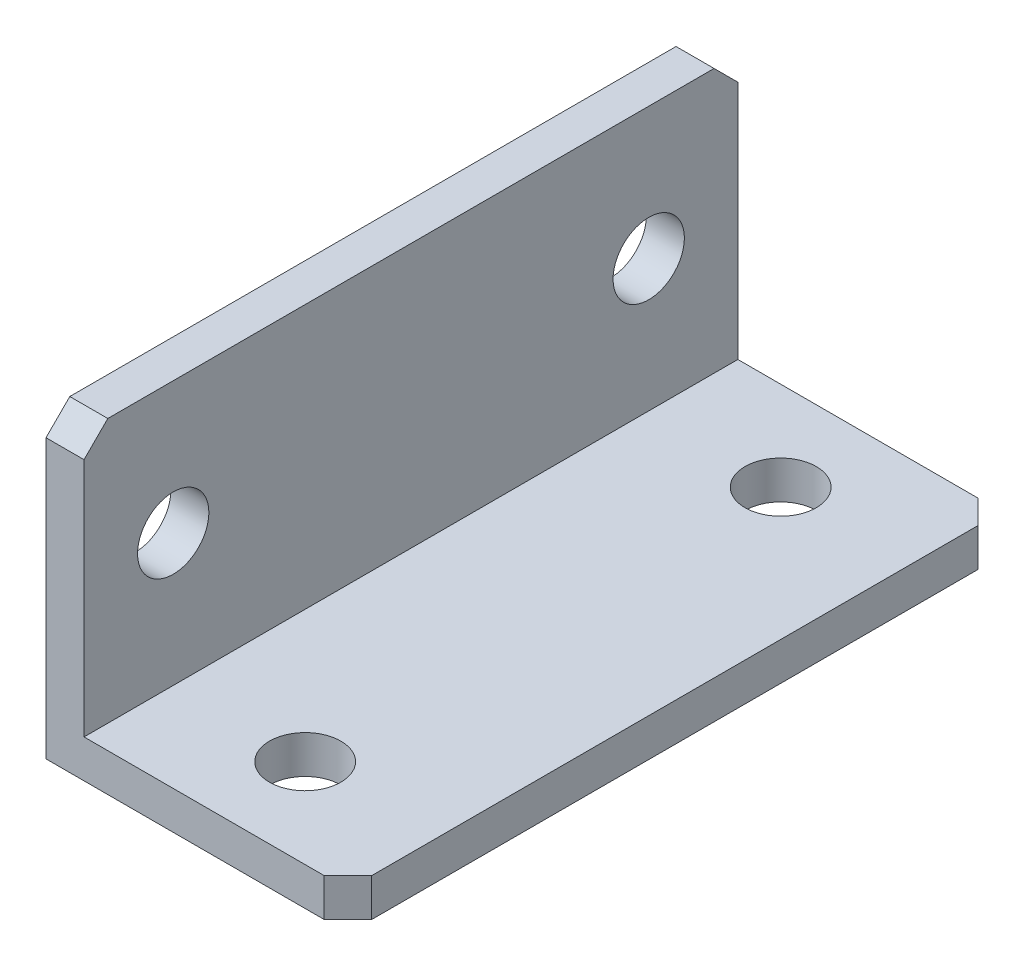
from build123d import *

# Parameters (mm, degrees)
RESSALTO_EXTRUS_O1_DEPTH = 55
CHANFRO1_SIZE            = 2
ESBO_O2_R                = 3
CORTE_EXTRUS_O1_DEPTH    = 64.329929733
ESBO_O3_R                = 3
CORTE_EXTRUS_O2_DEPTH    = 64.329929733


with BuildPart() as part:
    # Esboço1 → Ressalto-extrusão1 (new body)
    with BuildSketch(Plane.XY):
        Polygon((0, 0), (0, 22.2), (-3.2, 22.2), (-3.2, -3.2), (22.2, -3.2), (22.2, 0), align=None)
    extrude(amount=RESSALTO_EXTRUS_O1_DEPTH)

    # Chanfro1
    chanfro1_edges = [part.edges().sort_by_distance(p)[0] for p in [
        (-1.6, 22.2, 55),
        (22.2, -1.6, 55),
        (22.2, -1.6, 0),
        (-1.6, 22.2, 0),
    ]]
    chamfer(chanfro1_edges, length=CHANFRO1_SIZE)

    # Esboço2 → Corte-extrusão1 (cut, through all)
    with BuildSketch(Plane(origin=(0, 0, 0), x_dir=(1, 0, 0), z_dir=(0, 1, 0))):
        with Locations(Location((11.1, -7.5, 0), (0, 0, 180))):
            Circle(ESBO_O2_R)
        with Locations(Location((11.1, -47.5, 0), (0, 0, 180))):
            Circle(ESBO_O2_R)
    extrude(amount=-CORTE_EXTRUS_O1_DEPTH, mode=Mode.SUBTRACT)

    # Esboço3 → Corte-extrusão2 (cut, through all)
    with BuildSketch(Plane(origin=(0, 0, 0), x_dir=(0, 0, -1), z_dir=(1, 0, 0))):
        with Locations(Location((-47.5, 11.1, 0), (0, 0, 90))):
            Circle(ESBO_O3_R)
        with Locations(Location((-7.5, 11.1, 0), (0, 0, 90))):
            Circle(ESBO_O3_R)
    extrude(amount=-CORTE_EXTRUS_O2_DEPTH, mode=Mode.SUBTRACT)


solid = part.part
